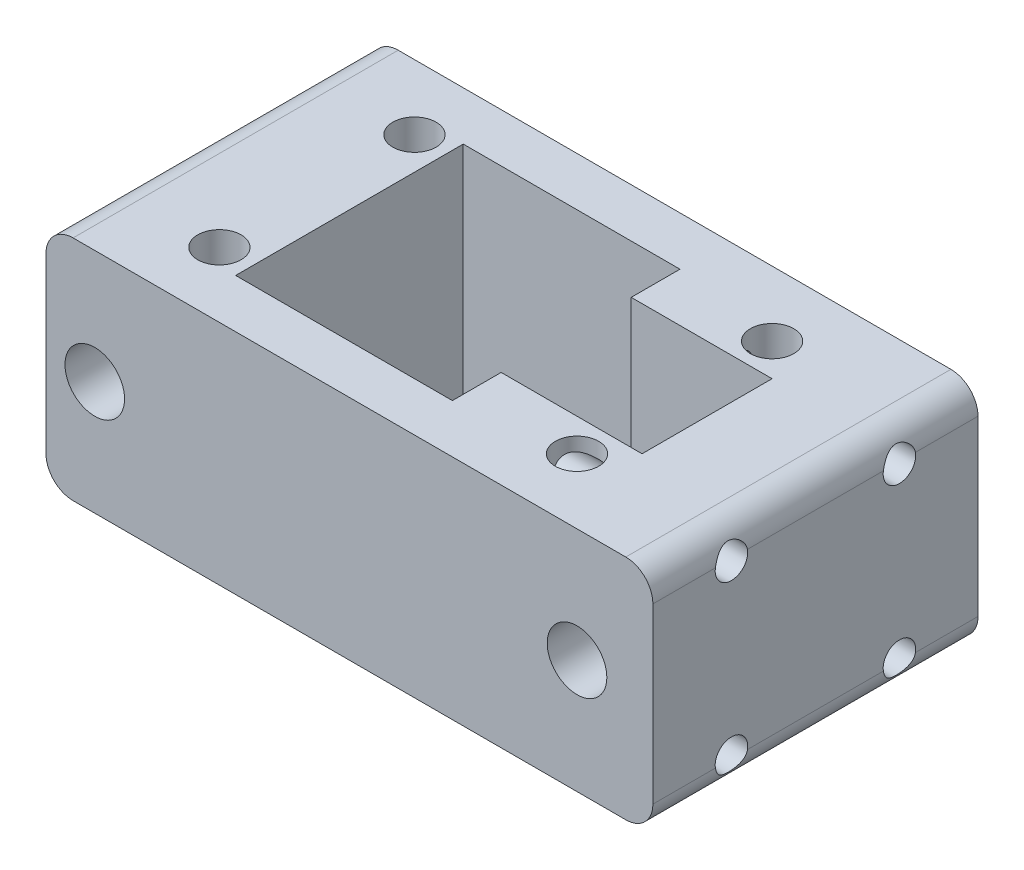
from build123d import *

# Parameters (mm, degrees)
SKETCH_1_W          = 112
SKETCH_1_H          = 42
SKETCH_1_R          = 4
EXTRUDE_1_DEPTH     = 60
SKETCH_3_R          = 4
CUT_EXTRUDE_2_DEPTH = 95.047860156
FILLET_1_R          = 5
SKETCH_6_R          = 5.5
CUT_EXTRUDE_4_DEPTH = 10
SKETCH_7_R          = 5.5
CUT_EXTRUDE_5_DEPTH = 42
CUT_EXTRUDE_7_DEPTH = 95.047860156
CUT_EXTRUDE_8_REACH = 130.783
SKETCH_10_R         = 1.75
SKETCH_11_R         = 3
CUT_EXTRUDE_9_DEPTH = 40


with BuildPart() as part:
    # 草圖1 → 填料-伸長1 (new body)
    with BuildSketch(Plane.XY):
        with Locations((-3, 0)):
            Rectangle(SKETCH_1_W, SKETCH_1_H)
        with Locations((39, 0)):
            Circle(SKETCH_1_R, mode=Mode.SUBTRACT)
        with Locations((-50, 0)):
            Circle(SKETCH_1_R, mode=Mode.SUBTRACT)
    extrude(amount=EXTRUDE_1_DEPTH)

    # 草圖3 → 除料-伸長2 (cut, through all)
    with BuildSketch(Plane(origin=(0, 21, 0), x_dir=(1, 0, 0), z_dir=(0, 1, 0))):
        with Locations(Location((-39, -12, 0), (0, 0, 180))):
            Circle(SKETCH_3_R)
        with Locations(Location((27, -12, 0), (0, 0, 180))):
            Circle(SKETCH_3_R)
        with Locations(Location((27, -48, 0), (0, 0, 180))):
            Circle(SKETCH_3_R)
        with Locations(Location((-39, -48, 0), (0, 0, 180))):
            Circle(SKETCH_3_R)
    extrude(amount=-CUT_EXTRUDE_2_DEPTH, mode=Mode.SUBTRACT)

    # 圓角1
    fillet_1_edges = [part.edges().sort_by_distance(p)[0] for p in [
        (-59, 21, 30),
        (53, 21, 30),
        (53, -21, 30),
        (-59, -21, 30),
    ]]
    fillet(fillet_1_edges, radius=FILLET_1_R)

    # 草圖6 → 除料-伸長4 (cut)
    with BuildSketch(Plane.XY.offset(60)):
        with Locations((39, 0)):
            Circle(SKETCH_6_R)
    extrude(amount=-CUT_EXTRUDE_4_DEPTH, mode=Mode.SUBTRACT)

    # 草圖7 → 除料-伸長5 (cut)
    with BuildSketch(Plane.XY.offset(60)):
        with Locations((-50, 0)):
            Circle(SKETCH_7_R)
    extrude(amount=-CUT_EXTRUDE_5_DEPTH, mode=Mode.SUBTRACT)

    # 草圖9 → 除料-伸長7 (cut, through all)
    with BuildSketch(Plane.XZ.offset(21)):
        Polygon((-33, 51), (7, 51), (7, 42), (33, 42), (33, 18), (7, 18), (7, 9), (-33, 9), align=None)
    extrude(amount=-CUT_EXTRUDE_7_DEPTH, mode=Mode.SUBTRACT)

    # 除料-伸長8: up to this face of the body (flat: up to its plane)
    cut_extrude_8_end = Plane(part.part.faces().sort_by_distance((7, 0, 46.5))[0])
    # 草圖10 → 除料-伸長8 (cut, up to the picked face)
    with BuildSketch(Plane(origin=(53, 0, 0), x_dir=(0, 0, -1), z_dir=(1, 0, 0)), mode=Mode.PRIVATE) as cut_extrude_8_sk1:
        with Locations((-45.5, -15.5)):
            Circle(SKETCH_10_R)
    cut_extrude_8_tool1 = split(extrude(cut_extrude_8_sk1.sketch, amount=-CUT_EXTRUDE_8_REACH, mode=Mode.PRIVATE), bisect_by=cut_extrude_8_end, keep=Keep.BOTH, mode=Mode.PRIVATE)
    # 草圖10 → 除料-伸長8 (cut, up to the picked face)
    with BuildSketch(Plane(origin=(53, 0, 0), x_dir=(0, 0, -1), z_dir=(1, 0, 0)), mode=Mode.PRIVATE) as cut_extrude_8_sk2:
        with Locations((-45.5, 15.5)):
            Circle(SKETCH_10_R)
    cut_extrude_8_tool2 = split(extrude(cut_extrude_8_sk2.sketch, amount=-CUT_EXTRUDE_8_REACH, mode=Mode.PRIVATE), bisect_by=cut_extrude_8_end, keep=Keep.BOTH, mode=Mode.PRIVATE)
    # 草圖10 → 除料-伸長8 (cut, up to the picked face)
    with BuildSketch(Plane(origin=(53, 0, 0), x_dir=(0, 0, -1), z_dir=(1, 0, 0)), mode=Mode.PRIVATE) as cut_extrude_8_sk3:
        with Locations((-14.5, 15.5)):
            Circle(SKETCH_10_R)
    cut_extrude_8_tool3 = split(extrude(cut_extrude_8_sk3.sketch, amount=-CUT_EXTRUDE_8_REACH, mode=Mode.PRIVATE), bisect_by=cut_extrude_8_end, keep=Keep.BOTH, mode=Mode.PRIVATE)
    # 草圖10 → 除料-伸長8 (cut, up to the picked face)
    with BuildSketch(Plane(origin=(53, 0, 0), x_dir=(0, 0, -1), z_dir=(1, 0, 0)), mode=Mode.PRIVATE) as cut_extrude_8_sk4:
        with Locations((-14.5, -15.5)):
            Circle(SKETCH_10_R)
    cut_extrude_8_tool4 = split(extrude(cut_extrude_8_sk4.sketch, amount=-CUT_EXTRUDE_8_REACH, mode=Mode.PRIVATE), bisect_by=cut_extrude_8_end, keep=Keep.BOTH, mode=Mode.PRIVATE)
    add(cut_extrude_8_tool1.solids().sort_by(Axis((53, -15.5, 45.5), (-1, 0, 0)))[0], mode=Mode.SUBTRACT)
    add(cut_extrude_8_tool2.solids().sort_by(Axis((53, 15.5, 45.5), (-1, 0, 0)))[0], mode=Mode.SUBTRACT)
    add(cut_extrude_8_tool3.solids().sort_by(Axis((53, 15.5, 14.5), (-1, 0, 0)))[0], mode=Mode.SUBTRACT)
    add(cut_extrude_8_tool4.solids().sort_by(Axis((53, -15.5, 14.5), (-1, 0, 0)))[0], mode=Mode.SUBTRACT)

    # 草圖11 → 除料-伸長9 (cut)
    with BuildSketch(Plane(origin=(53, 0, 0), x_dir=(0, 0, -1), z_dir=(1, 0, 0))):
        with Locations((-45.5, -15.5)):
            Circle(SKETCH_11_R)
        with Locations((-45.5, 15.5)):
            Circle(SKETCH_11_R)
        with Locations((-14.5, 15.5)):
            Circle(SKETCH_11_R)
        with Locations((-14.5, -15.5)):
            Circle(SKETCH_11_R)
    extrude(amount=-CUT_EXTRUDE_9_DEPTH, mode=Mode.SUBTRACT)


solid = part.part
